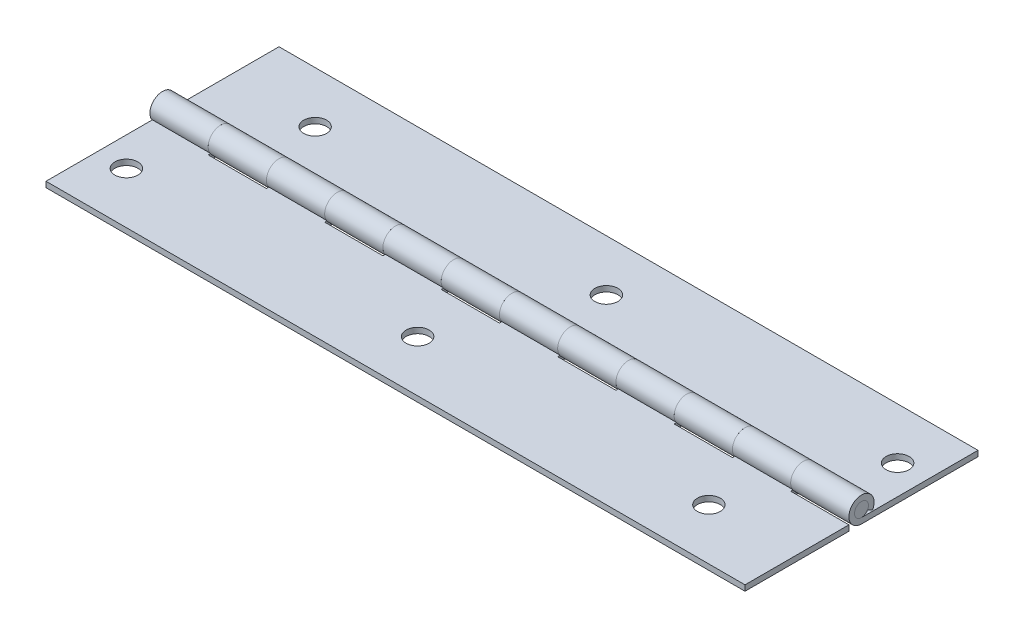
from build123d import *

# Parameters (mm, degrees)
BOSS_EXTRUDE1_DEPTH = 76.2
SKETCH4_W           = 12.7
SKETCH4_H           = 5.4864
CUT_EXTRUDE1_DEPTH  = 81.368682621
LPATTERN1_COUNT     = 6
LPATTERN1_PITCH     = 25.4
SKETCH5_R           = 2.5019
CUT_EXTRUDE2_DEPTH  = 81.435122899
CIRPATTERN1_COUNT   = 2
SKETCH6_R           = 1.524
BOSS_EXTRUDE2_DEPTH = 76.2


with BuildPart() as part:
    # Sketch3 → Boss-Extrude1 (new, symmetric)
    with BuildSketch(Plane(origin=(0, 0, 0), x_dir=(0, 0, -1), z_dir=(1, 0, 0))):
        with BuildLine():
            Line((0, -2.7432), (-25.4, -2.7432))
            Line((-25.4, -2.7432), (-25.4, -1.524))
            Line((-25.4, -1.524), (0, -1.524))
            ThreePointArc((0, -1.524), (0.77286266, 1.313491267), (-1.332215689, -0.740119827))
            Line((-1.332215689, -0.740119827), (-2.39798824, -1.332215689))
            ThreePointArc((-2.39798824, -1.332215689), (1.391152789, 2.36428428), (0, -2.7432))
        make_face()
    extrude(amount=BOSS_EXTRUDE1_DEPTH, both=True)

    # Sketch4 → Cut-Extrude1 (cut, symmetric)
    with BuildSketch(Plane(origin=(0, 0, 0), x_dir=(1, 0, 0), z_dir=(0, 1, 0))):
        with Locations((-57.15, 0)):
            Rectangle(SKETCH4_W, SKETCH4_H)
    cut_extrude1 = extrude(amount=CUT_EXTRUDE1_DEPTH, both=True, mode=Mode.SUBTRACT)

    # LPattern1: Cut-Extrude1 ×6
    with Locations(*[(i * LPATTERN1_PITCH, 0, 0) for i in range(1, LPATTERN1_COUNT)]):
        add(cut_extrude1, mode=Mode.SUBTRACT)

    # Sketch5 → Cut-Extrude2 (cut, through all)
    with BuildSketch(Plane(origin=(0, -1.524, 0), x_dir=(1, 0, 0), z_dir=(0, 1, 0))):
        with Locations(Location((57.15, -14.224, 0), (0, 0, 270))):
            Circle(SKETCH5_R)
        with Locations(Location((-6.35, -14.224, 0), (0, 0, 270))):
            Circle(SKETCH5_R)
        with Locations(Location((-69.85, -14.224, 0), (0, 0, 270))):
            Circle(SKETCH5_R)
    extrude(amount=-CUT_EXTRUDE2_DEPTH, mode=Mode.SUBTRACT)


with BuildPart() as cirpattern1_1:
    # CirPattern1: pattern copy
    add(part.part.rotate(Axis((0, 0, 0), (0, 1, 0)), 1 * 360 / CIRPATTERN1_COUNT))


with BuildPart() as body_3:
    # Sketch6 → Boss-Extrude2 (new, symmetric)
    with BuildSketch(Plane(origin=(0, 0, 0), x_dir=(0, 0, -1), z_dir=(1, 0, 0))):
        with Locations(Location((0, 0, 0), (0, 0, 180))):
            Circle(SKETCH6_R)
    extrude(amount=BOSS_EXTRUDE2_DEPTH, both=True)


solid = Compound([part.part, cirpattern1_1.part, body_3.part])
